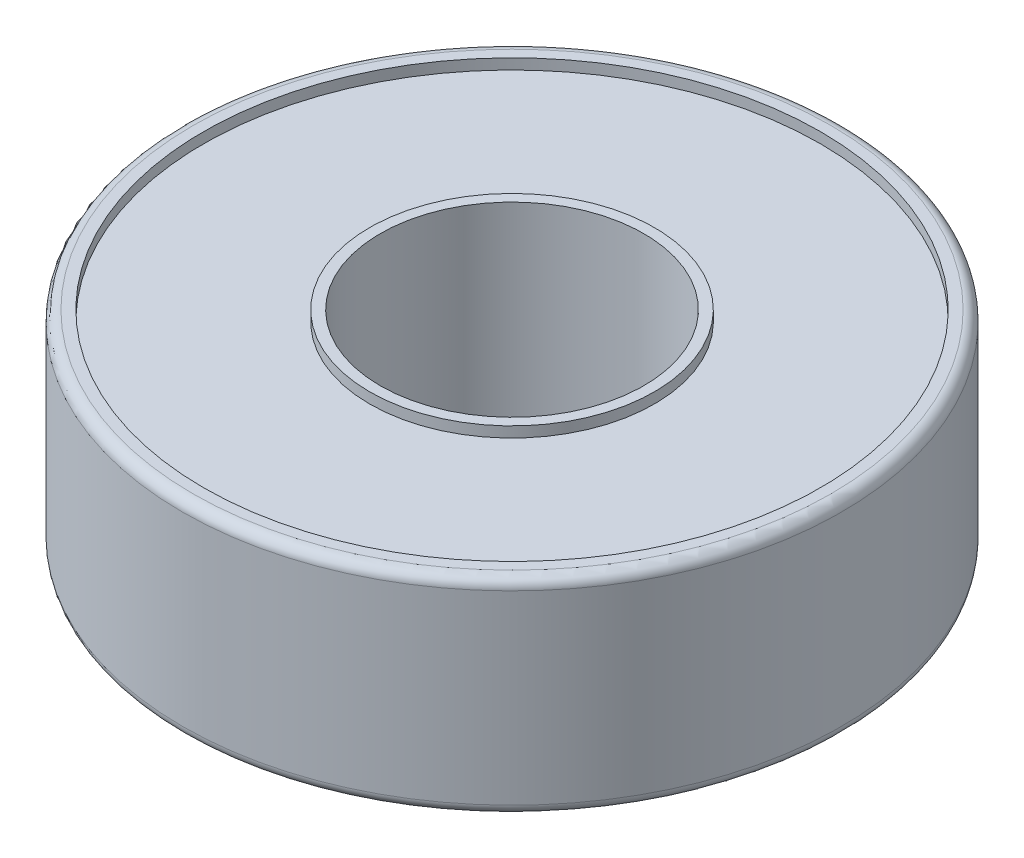
from build123d import *

# Parameters (mm, degrees)
BOSS_EXTRUDE1_DEPTH      = 2.4892
BOSS_EXTRUDE1_DEPTH_BACK = 2.4892
SKETCH1_R                = 7.9375
SKETCH1_R_2              = 3.175
FILLET1_R                = 0.254
SKETCH2_R                = 7.4295
SKETCH2_R_2              = 3.429
CUT_EXTRUDE1_DEPTH       = 0.254


with BuildPart() as part:
    # Sketch1 → Boss-Extrude1 (new, two sides: drawn at the far end of the back side and taken through both)
    with BuildSketch(Plane(origin=(0, 0, 0), x_dir=(1, 0, 0), z_dir=(0, 1, 0)).offset(-BOSS_EXTRUDE1_DEPTH_BACK)):
        Circle(SKETCH1_R)
        Circle(SKETCH1_R_2, mode=Mode.SUBTRACT)
    extrude(amount=BOSS_EXTRUDE1_DEPTH + BOSS_EXTRUDE1_DEPTH_BACK)

    # Fillet1
    fillet1_edges = [part.edges().sort_by_distance(p)[0] for p in [
        (-7.9375, -2.4892, 0),
        (-7.9375, 2.4892, 0),
    ]]
    fillet(fillet1_edges, radius=FILLET1_R)

    # Sketch2 → Cut-Extrude1 (cut)
    with BuildSketch(Plane(origin=(0, 2.4892, 0), x_dir=(1, 0, 0), z_dir=(0, 1, 0))):
        Circle(SKETCH2_R)
        Circle(SKETCH2_R_2, mode=Mode.SUBTRACT)
    cut_extrude1 = extrude(amount=-CUT_EXTRUDE1_DEPTH, mode=Mode.SUBTRACT)

    # Mirror1: Cut-Extrude1 across plane
    add(cut_extrude1.mirror(Plane.ZX), mode=Mode.SUBTRACT)


solid = part.part
